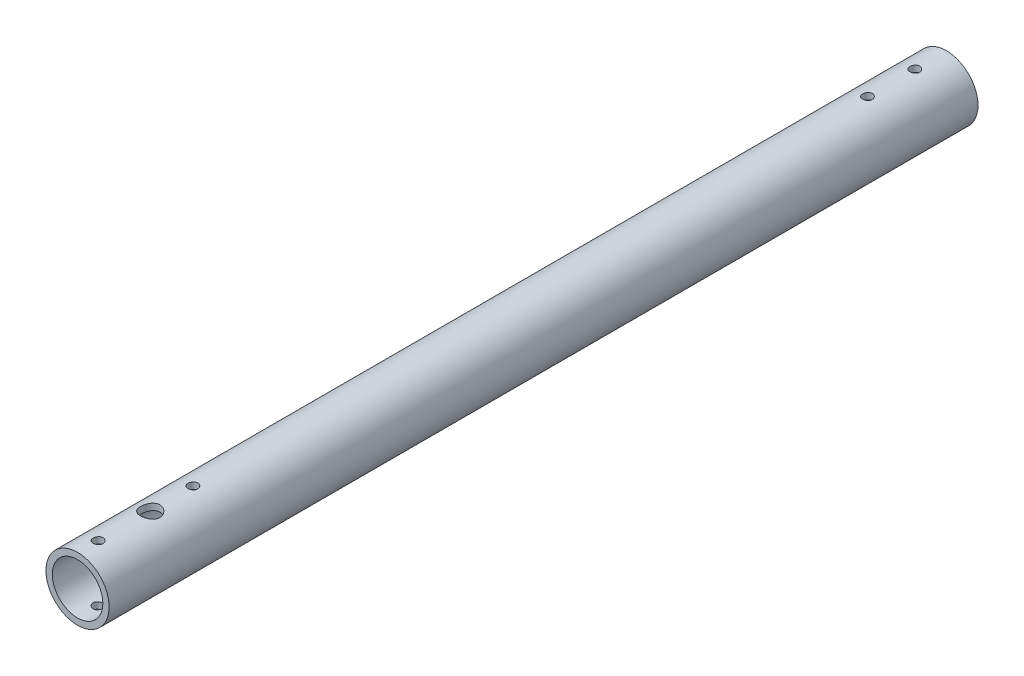
from build123d import *

# Parameters (mm, degrees)
SKETCH_1_R               = 10
SKETCH_1_R_2             = 8
EXTRUDE_1_DEPTH          = 275
CUT_EXTRUDE_1_DEPTH      = 276.36339626
CUT_EXTRUDE_1_DEPTH_BACK = 276.36339626
SKETCH_4_R               = 1.55
SKETCH_4_R_2             = 3.05


with BuildPart() as part:
    # 草图1 → 凸台-拉伸1 (new body)
    with BuildSketch(Plane.XY):
        Circle(SKETCH_1_R)
        Circle(SKETCH_1_R_2, mode=Mode.SUBTRACT)
    extrude(amount=EXTRUDE_1_DEPTH)

    # 草图4 → 切除-拉伸1 (cut, two sides: drawn at the far end of the back side and taken through both)
    with BuildSketch(Plane(origin=(0, 0, 0), x_dir=(1, 0, 0), z_dir=(0, 1, 0)).offset(-CUT_EXTRUDE_1_DEPTH_BACK)):
        with Locations(Location((0, -268.5, 0), (0, 0, 270))):
            Circle(SKETCH_4_R)
        with Locations(Location((0, -252, 0), (0, 0, 270))):
            Circle(SKETCH_4_R_2)
        with Locations(Location((0, -238.5, 0), (0, 0, 270))):
            Circle(SKETCH_4_R)
        with Locations(Location((0, -25, 0), (0, 0, 270))):
            Circle(SKETCH_4_R)
        with Locations(Location((0, -10, 0), (0, 0, 270))):
            Circle(SKETCH_4_R)
    extrude(amount=CUT_EXTRUDE_1_DEPTH + CUT_EXTRUDE_1_DEPTH_BACK, mode=Mode.SUBTRACT)


solid = part.part
